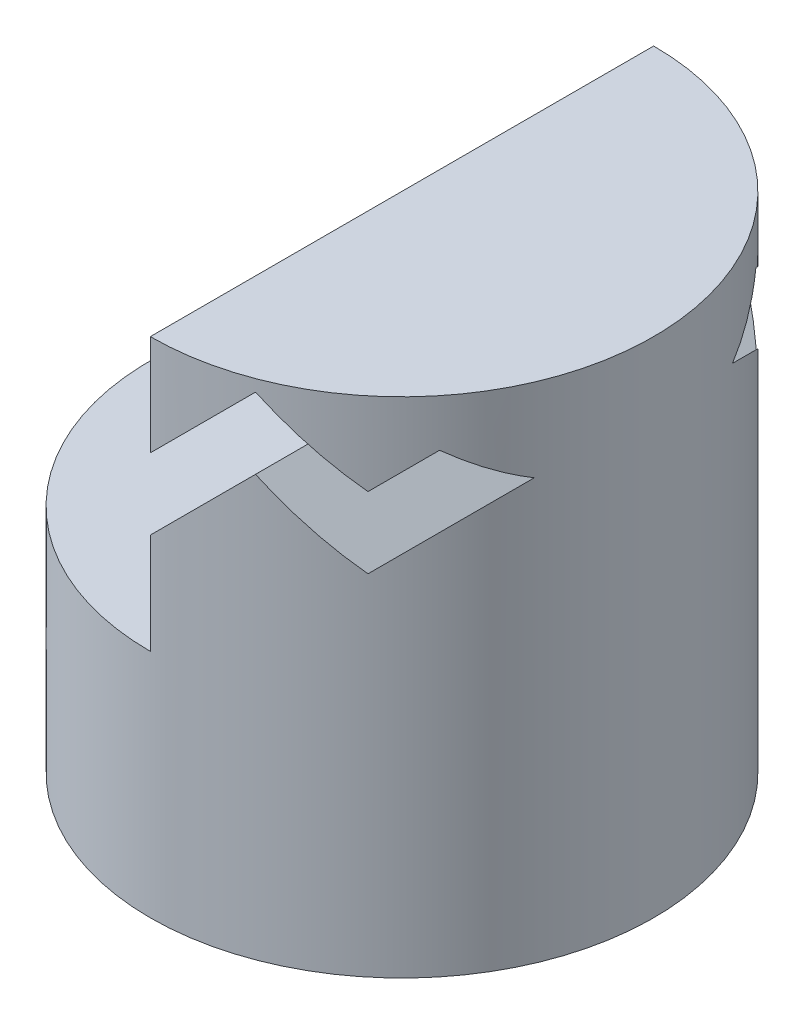
from build123d import *

# Parameters (mm, degrees)
SKETCH_1_R               = 50
EXTRUDE_1_DEPTH          = 100
CUT_EXTRUDE_1_DEPTH      = 123.474487139
CUT_EXTRUDE_1_DEPTH_BACK = 123.474487139


with BuildPart() as part:
    # 草图1 → 凸台-拉伸1 (new body)
    with BuildSketch(Plane(origin=(0, 0, 0), x_dir=(1, 0, 0), z_dir=(0, 1, 0))):
        with Locations(Location((0, 0, 0), (0, 0, 270))):
            Circle(SKETCH_1_R)
    extrude(amount=EXTRUDE_1_DEPTH)

    # 草图2 → 切除-拉伸1 (cut, two sides: drawn at the far end of the back side and taken through both)
    with BuildSketch(Plane.XY.offset(-CUT_EXTRUDE_1_DEPTH_BACK)):
        Polygon((0, 100), (0, 80), (17.67766953, 97.67766953), (31.819805153, 83.535533906), (38.890872965, 90.606601718), (45.961940777, 83.535533906), (31.819805153, 69.393398282), (17.67766953, 83.535533906), (0, 65.857864376), (0, 45.857864376), (-50, 45.857864376), (-50, 100), align=None)
    extrude(amount=CUT_EXTRUDE_1_DEPTH + CUT_EXTRUDE_1_DEPTH_BACK, mode=Mode.SUBTRACT)


solid = part.part
